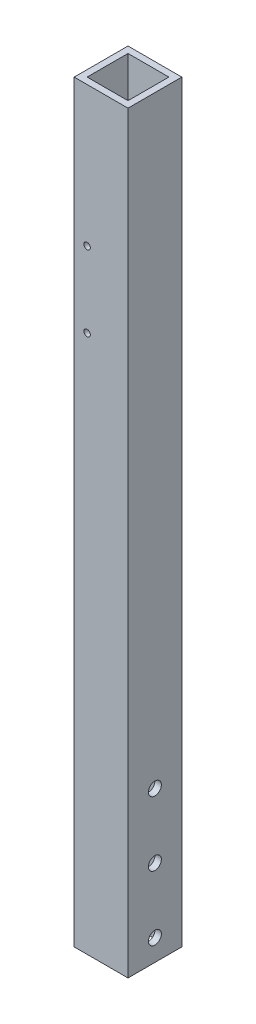
from build123d import *

# Parameters (mm, degrees)
SKETCH_1_W               = 25
SKETCH_1_H               = 25
SKETCH_1_W_2             = 19
SKETCH_1_H_2             = 19
EXTRUDE_1_DEPTH          = 350
SKETCH_2_R               = 3
CUT_EXTRUDE_1_DEPTH      = 352.781181987
CUT_EXTRUDE_2_DEPTH      = 352.781181987
CUT_EXTRUDE_2_DEPTH_BACK = 352.781181987
SKETCH_3_R               = 1.5


with BuildPart() as part:
    # 草图1 → 凸台-拉伸1 (new body)
    with BuildSketch(Plane(origin=(0, 0, 0), x_dir=(1, 0, 0), z_dir=(0, 1, 0))):
        with Locations((12.5, 12.5)):
            Rectangle(SKETCH_1_W, SKETCH_1_H)
        with Locations((12.5, 12.5)):
            Rectangle(SKETCH_1_W_2, SKETCH_1_H_2, mode=Mode.SUBTRACT)
    extrude(amount=EXTRUDE_1_DEPTH)

    # 草图2 → 切除-拉伸1 (cut, through all)
    with BuildSketch(Plane(origin=(0, 0, 0), x_dir=(0, 0, -1), z_dir=(1, 0, 0))):
        with Locations(Location((12.5, 10, 0), (0, 0, 180))):
            Circle(SKETCH_2_R)
        with Locations(Location((12.5, 40, 0), (0, 0, 180))):
            Circle(SKETCH_2_R)
        with Locations(Location((12.5, 70, 0), (0, 0, 180))):
            Circle(SKETCH_2_R)
    extrude(amount=CUT_EXTRUDE_1_DEPTH, mode=Mode.SUBTRACT)

    # 草图3 → 切除-拉伸2 (cut, two sides: drawn at the far end of the back side and taken through both)
    with BuildSketch(Plane.XY.offset(-CUT_EXTRUDE_2_DEPTH_BACK)):
        with Locations((6, 250)):
            Circle(SKETCH_3_R)
        with Locations((6, 285)):
            Circle(SKETCH_3_R)
    extrude(amount=CUT_EXTRUDE_2_DEPTH + CUT_EXTRUDE_2_DEPTH_BACK, mode=Mode.SUBTRACT)


solid = part.part
